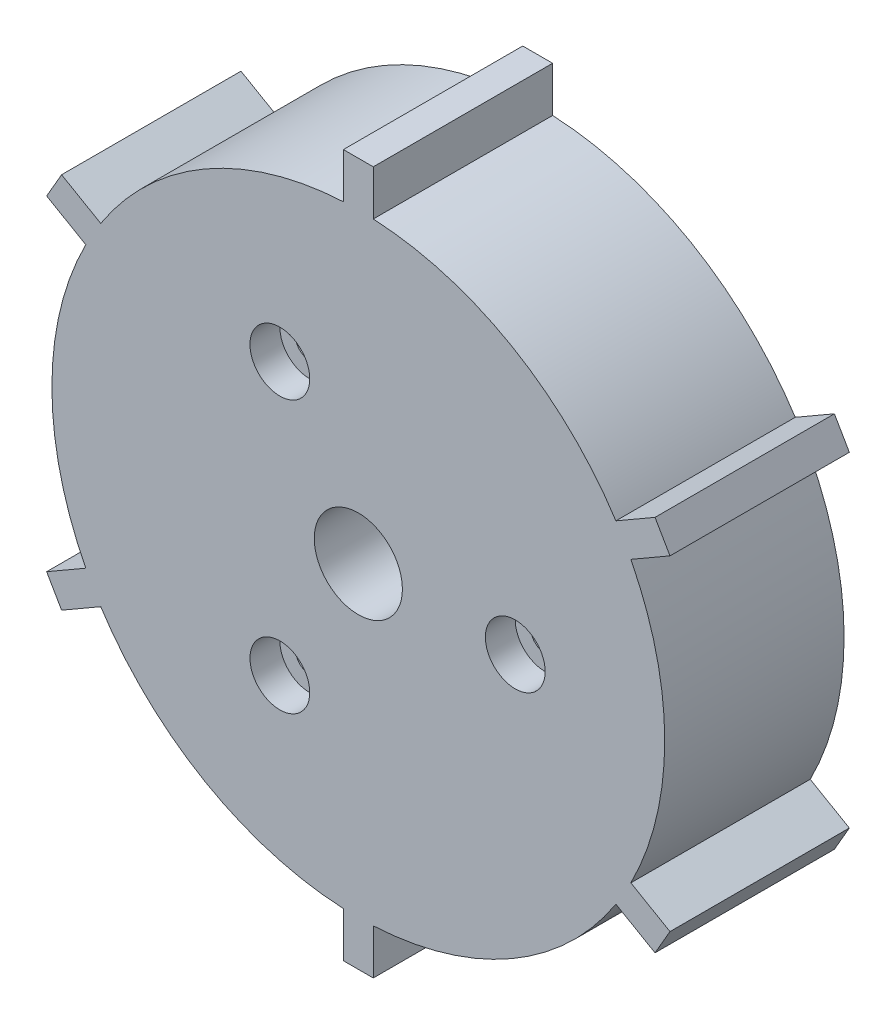
from build123d import *

# Parameters (mm, degrees)
SKETCH1_R           = 0.95
SKETCH1_R_2         = 2.949148862
BOSS_EXTRUDE1_DEPTH = 5
SKETCH2_R           = 2
CUT_EXTRUDE1_DEPTH  = 2
BOSS_EXTRUDE2_START = -7
SKETCH1_3_R         = 18.5
BOSS_EXTRUDE2_DEPTH = 7


with BuildPart() as part:
    # Sketch1 → Boss-Extrude1 (new body)
    with BuildSketch(Plane.XY):
        with BuildLine():
            Line((20.851596989, 10.883974596), (19.851596989, 12.616025404))
            Line((19.851596989, 12.616025404), (17.232385626, 11.103823019))
            ThreePointArc((17.232385626, 11.103823019), (10.25, 17.753520778), (1, 20.475595229))
            Line((1, 20.475595229), (1, 23.5))
            Line((1, 23.5), (-1, 23.5))
            Line((-1, 23.5), (-1, 20.475595229))
            ThreePointArc((-1, 20.475595229), (-10.25, 17.753520778), (-17.232385626, 11.103823019))
            Line((-17.232385626, 11.103823019), (-19.851596989, 12.616025404))
            Line((-19.851596989, 12.616025404), (-20.851596989, 10.883974596))
            Line((-20.851596989, 10.883974596), (-18.232385626, 9.371772211))
            ThreePointArc((-18.232385626, 9.371772211), (-20.5, 0), (-18.232385626, -9.371772211))
            Line((-18.232385626, -9.371772211), (-20.851596989, -10.883974596))
            Line((-20.851596989, -10.883974596), (-19.851596989, -12.616025404))
            Line((-19.851596989, -12.616025404), (-17.232385626, -11.103823019))
            ThreePointArc((-17.232385626, -11.103823019), (-10.25, -17.753520778), (-1, -20.475595229))
            Line((-1, -20.475595229), (-1, -23.5))
            Line((-1, -23.5), (1, -23.5))
            Line((1, -23.5), (1, -20.475595229))
            ThreePointArc((1, -20.475595229), (10.25, -17.753520778), (17.232385626, -11.103823019))
            Line((17.232385626, -11.103823019), (19.851596989, -12.616025404))
            Line((19.851596989, -12.616025404), (20.851596989, -10.883974596))
            Line((20.851596989, -10.883974596), (18.232385626, -9.371772211))
            ThreePointArc((18.232385626, -9.371772211), (20.5, 0), (18.232385626, 9.371772211))
            Line((18.232385626, 9.371772211), (20.851596989, 10.883974596))
        make_face()
        with Locations((10.5, 0)):
            Circle(SKETCH1_R, mode=Mode.SUBTRACT)
        with Locations((-5.25, -9.09)):
            Circle(SKETCH1_R, mode=Mode.SUBTRACT)
        with Locations((-5.25, 9.09)):
            Circle(SKETCH1_R, mode=Mode.SUBTRACT)
        Circle(SKETCH1_R_2, mode=Mode.SUBTRACT)
    extrude(amount=BOSS_EXTRUDE1_DEPTH)

    # Sketch2 → Cut-Extrude1 (cut)
    with BuildSketch(Plane.XY.offset(5)):
        with Locations((-5.25, 9.09)):
            Circle(SKETCH2_R)
        with Locations((-5.25, -9.09)):
            Circle(SKETCH2_R)
        with Locations((10.5, 0)):
            Circle(SKETCH2_R)
    extrude(amount=-CUT_EXTRUDE1_DEPTH, mode=Mode.SUBTRACT)

    # Sketch1<3> → Boss-Extrude2 (add)
    with BuildSketch(Plane.XY.offset(BOSS_EXTRUDE2_START)):
        with BuildLine():
            Line((20.851596989, 10.883974596), (19.851596989, 12.616025404))
            Line((19.851596989, 12.616025404), (17.232385626, 11.103823019))
            ThreePointArc((17.232385626, 11.103823019), (10.25, 17.753520778), (1, 20.475595229))
            Line((1, 20.475595229), (1, 23.5))
            Line((1, 23.5), (-1, 23.5))
            Line((-1, 23.5), (-1, 20.475595229))
            ThreePointArc((-1, 20.475595229), (-10.25, 17.753520778), (-17.232385626, 11.103823019))
            Line((-17.232385626, 11.103823019), (-19.851596989, 12.616025404))
            Line((-19.851596989, 12.616025404), (-20.851596989, 10.883974596))
            Line((-20.851596989, 10.883974596), (-18.232385626, 9.371772211))
            ThreePointArc((-18.232385626, 9.371772211), (-20.5, 0), (-18.232385626, -9.371772211))
            Line((-18.232385626, -9.371772211), (-20.851596989, -10.883974596))
            Line((-20.851596989, -10.883974596), (-19.851596989, -12.616025404))
            Line((-19.851596989, -12.616025404), (-17.232385626, -11.103823019))
            ThreePointArc((-17.232385626, -11.103823019), (-10.25, -17.753520778), (-1, -20.475595229))
            Line((-1, -20.475595229), (-1, -23.5))
            Line((-1, -23.5), (1, -23.5))
            Line((1, -23.5), (1, -20.475595229))
            ThreePointArc((1, -20.475595229), (10.25, -17.753520778), (17.232385626, -11.103823019))
            Line((17.232385626, -11.103823019), (19.851596989, -12.616025404))
            Line((19.851596989, -12.616025404), (20.851596989, -10.883974596))
            Line((20.851596989, -10.883974596), (18.232385626, -9.371772211))
            ThreePointArc((18.232385626, -9.371772211), (20.5, 0), (18.232385626, 9.371772211))
            Line((18.232385626, 9.371772211), (20.851596989, 10.883974596))
        make_face()
        Circle(SKETCH1_3_R, mode=Mode.SUBTRACT)
    extrude(amount=BOSS_EXTRUDE2_DEPTH)


solid = part.part
